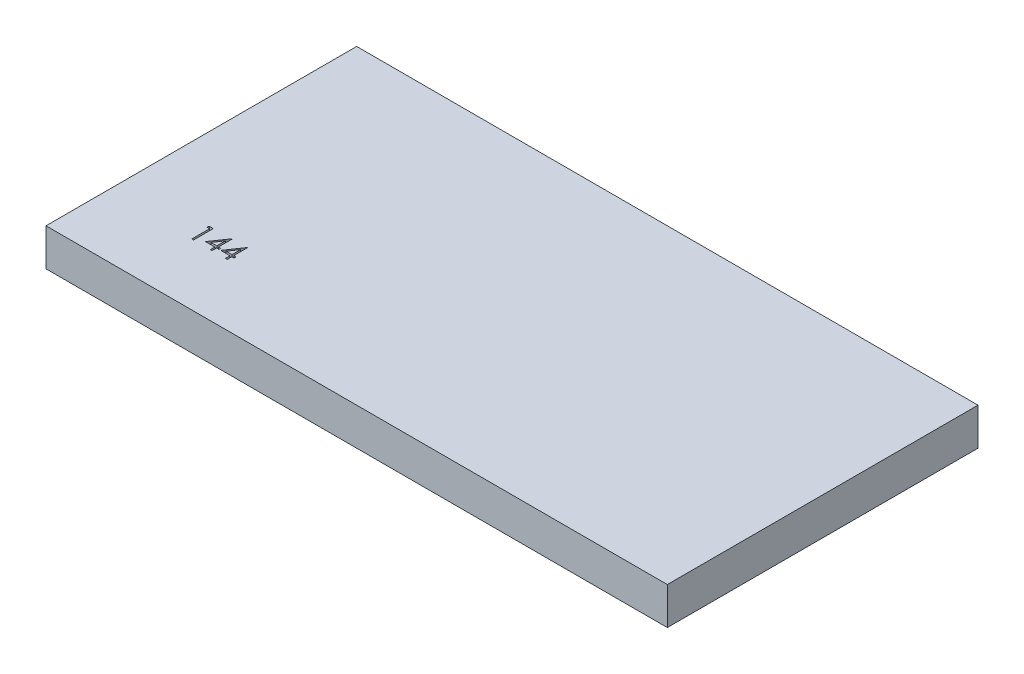
from build123d import *

# Parameters (mm, degrees)
SKETCH1_W           = 100
SKETCH1_H           = 50
BOSS_EXTRUDE1_DEPTH = 6
CUT_EXTRUDE1_DEPTH  = 1


with BuildPart() as part:
    # Sketch1 → Boss-Extrude1 (new body)
    with BuildSketch(Plane(origin=(0, 0, 0), x_dir=(1, 0, 0), z_dir=(0, 1, 0))):
        Rectangle(SKETCH1_W, SKETCH1_H)
    extrude(amount=BOSS_EXTRUDE1_DEPTH)

    # Sketch2 → Cut-Extrude1 (cut)
    # profile 1 of 3: a face of its own
    with BuildSketch(Plane(origin=(0, 6, 0), x_dir=(1, 0, 0), z_dir=(0, 1, 0))):
        Polygon((-36.733473762, -11.928699111), (-36.146429492, -11.928699111), (-36.146429492, -15.103699111), (-36.431365389, -15.103699111), (-36.431365389, -12.254340136), (-36.919826928, -12.254340136), align=None)
    # profile 2 of 3: a face of its own
    with BuildSketch(Plane(origin=(0, 6, 0), x_dir=(1, 0, 0), z_dir=(0, 1, 0))):
        Polygon((-33.232832737, -11.847288854), (-33.174955133, -11.847288854), (-33.174955133, -14.045365777), (-32.808608979, -14.045365777), (-32.808608979, -14.371006803), (-33.174955133, -14.371006803), (-33.174955133, -15.103699111), (-33.45989103, -15.103699111), (-33.45989103, -14.371006803), (-34.965980774, -14.371006803), align=None)
        Polygon((-33.45989103, -14.045365777), (-33.45989103, -12.666479559), (-34.406285261, -14.045365777), align=None, mode=Mode.SUBTRACT)
    # profile 3 of 3: a face of its own
    with BuildSketch(Plane(origin=(0, 6, 0), x_dir=(1, 0, 0), z_dir=(0, 1, 0))):
        Polygon((-30.790525045, -11.847288854), (-30.73264744, -11.847288854), (-30.73264744, -14.045365777), (-30.366301287, -14.045365777), (-30.366301287, -14.371006803), (-30.73264744, -14.371006803), (-30.73264744, -15.103699111), (-31.017583338, -15.103699111), (-31.017583338, -14.371006803), (-32.523673081, -14.371006803), align=None)
        Polygon((-31.017583338, -14.045365777), (-31.017583338, -12.666479559), (-31.963977569, -14.045365777), align=None, mode=Mode.SUBTRACT)
    extrude(amount=-CUT_EXTRUDE1_DEPTH, mode=Mode.SUBTRACT)


solid = part.part
